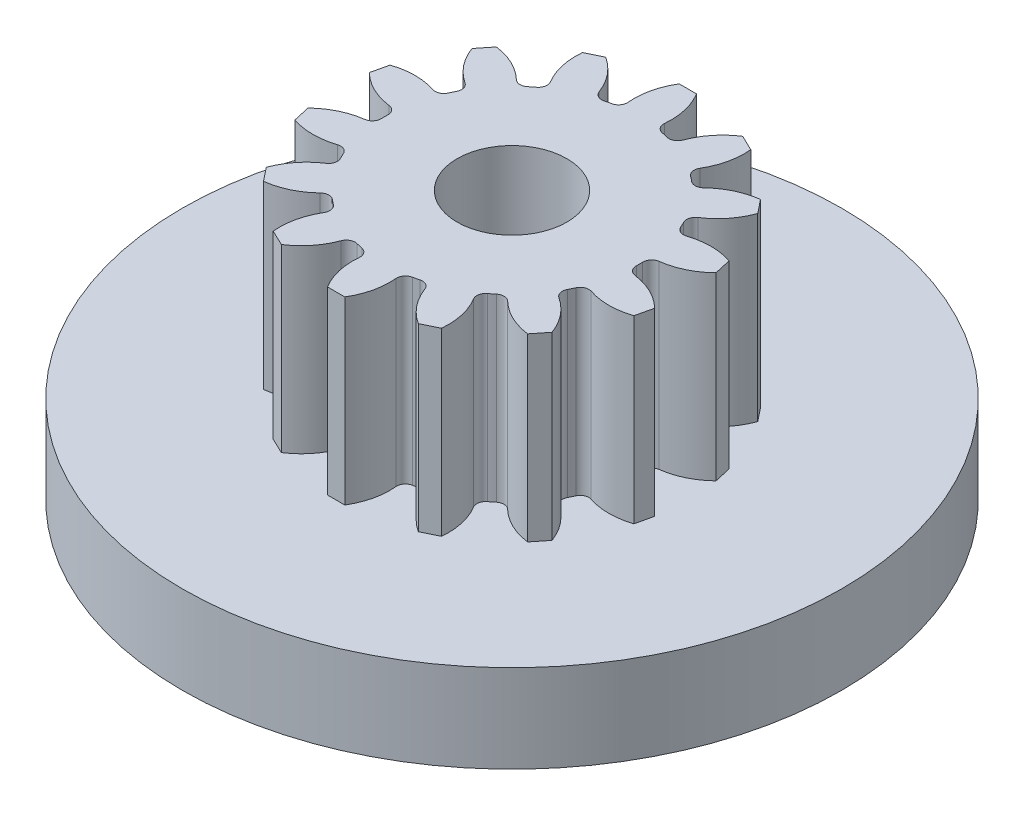
from build123d import *
from build123d.topology import SkipClean

# Parameters (mm, degrees)
SKETCH1_R           = 1.25
BOSS_EXTRUDE1_DEPTH = 4.1
BOSS_EXTRUDE2_START = 2
SKETCH2_R           = 7.5
SKETCH2_R_2         = 1.25
BOSS_EXTRUDE2_DEPTH = 2


with BuildPart() as part:
    # Sketch1 → Boss-Extrude1 (new body)
    with BuildSketch(Plane(origin=(0, 0, 0), x_dir=(1, 0, 0), z_dir=(0, 1, 0))):
        with BuildLine():
            Line((-0.197, 4), (0.197, 4))
            ThreePointArc((0.197, 4), (0.382537799, 3.546229716), (0.415450248, 3.057099349))
            ThreePointArc((0.415450248, 3.057099349), (0.454038062, 2.919195271), (0.574930224, 2.842438256))
            ThreePointArc((0.574930224, 2.842438256), (0.645310708, 2.827290945), (0.715293505, 2.810401253))
            ThreePointArc((0.715293505, 2.810401253), (0.8575172, 2.82710379), (0.952117956, 2.934608447))
            ThreePointArc((0.952117956, 2.934608447), (1.193996761, 3.361019503), (1.558044089, 3.689350568))
            Line((1.558044089, 3.689350568), (1.913025823, 3.518400375))
            ThreePointArc((1.913025823, 3.518400375), (1.883306057, 3.029065642), (1.700733436, 2.574094232))
            ThreePointArc((1.700733436, 2.574094232), (1.675665518, 2.433104326), (1.751281972, 2.311495502))
            ThreePointArc((1.751281972, 2.311495502), (1.808120425, 2.267311299), (1.863844584, 2.221729814))
            ThreePointArc((1.863844584, 2.221729814), (1.999230665, 2.175069732), (2.131107523, 2.230882351))
            ThreePointArc((2.131107523, 2.230882351), (2.534045619, 2.510118158), (3.004498439, 2.647980009))
            Line((3.004498439, 2.647980009), (3.250153421, 2.339938405))
            ThreePointArc((3.250153421, 2.339938405), (3.011062453, 1.911957968), (2.649165509, 1.581258184))
            ThreePointArc((2.649165509, 1.581258184), (2.565406867, 1.46510723), (2.580770847, 1.322732715))
            ThreePointArc((2.580770847, 1.322732715), (2.612809717, 1.258262843), (2.643238384, 1.193017539))
            ThreePointArc((2.643238384, 1.193017539), (2.744971977, 1.092236438), (2.888005108, 1.085302646))
            ThreePointArc((2.888005108, 1.085302646), (3.372195665, 1.162057126), (3.855875025, 1.082144535))
            Line((3.855875025, 1.082144535), (3.943548273, 0.698022937))
            ThreePointArc((3.943548273, 0.698022937), (3.542441002, 0.41616357), (3.072897863, 0.275234559))
            ThreePointArc((3.072897863, 0.275234559), (2.947037924, 0.206927678), (2.899106405, 0.071986492))
            ThreePointArc((2.899106405, 0.071986492), (2.9, 0), (2.899106405, -0.071986492))
            ThreePointArc((2.899106405, -0.071986492), (2.947037924, -0.206927678), (3.072897863, -0.275234559))
            ThreePointArc((3.072897863, -0.275234559), (3.542441002, -0.41616357), (3.943548273, -0.698022937))
            Line((3.943548273, -0.698022937), (3.855875025, -1.082144535))
            ThreePointArc((3.855875025, -1.082144535), (3.372195665, -1.162057126), (2.888005108, -1.085302646))
            ThreePointArc((2.888005108, -1.085302646), (2.744971977, -1.092236438), (2.643238384, -1.193017539))
            ThreePointArc((2.643238384, -1.193017539), (2.612809717, -1.258262843), (2.580770847, -1.322732715))
            ThreePointArc((2.580770847, -1.322732715), (2.565406867, -1.46510723), (2.649165509, -1.581258184))
            ThreePointArc((2.649165509, -1.581258184), (3.011062453, -1.911957968), (3.250153421, -2.339938405))
            Line((3.250153421, -2.339938405), (3.004498439, -2.647980009))
            ThreePointArc((3.004498439, -2.647980009), (2.534045619, -2.510118158), (2.131107523, -2.230882351))
            ThreePointArc((2.131107523, -2.230882351), (1.999230665, -2.175069732), (1.863844584, -2.221729814))
            ThreePointArc((1.863844584, -2.221729814), (1.808120425, -2.267311299), (1.751281972, -2.311495502))
            ThreePointArc((1.751281972, -2.311495502), (1.675665518, -2.433104326), (1.700733436, -2.574094232))
            ThreePointArc((1.700733436, -2.574094232), (1.883306057, -3.029065642), (1.913025823, -3.518400375))
            Line((1.913025823, -3.518400375), (1.558044089, -3.689350568))
            ThreePointArc((1.558044089, -3.689350568), (1.193996761, -3.361019503), (0.952117956, -2.934608447))
            ThreePointArc((0.952117956, -2.934608447), (0.8575172, -2.82710379), (0.715293505, -2.810401253))
            ThreePointArc((0.715293505, -2.810401253), (0.645310708, -2.827290945), (0.574930224, -2.842438256))
            ThreePointArc((0.574930224, -2.842438256), (0.454038062, -2.919195271), (0.415450248, -3.057099349))
            ThreePointArc((0.415450248, -3.057099349), (0.382537799, -3.546229716), (0.197, -4))
            Line((0.197, -4), (-0.197, -4))
            ThreePointArc((-0.197, -4), (-0.382537799, -3.546229716), (-0.415450248, -3.057099349))
            ThreePointArc((-0.415450248, -3.057099349), (-0.454038062, -2.919195271), (-0.574930224, -2.842438256))
            ThreePointArc((-0.574930224, -2.842438256), (-0.645310708, -2.827290945), (-0.715293505, -2.810401253))
            ThreePointArc((-0.715293505, -2.810401253), (-0.8575172, -2.82710379), (-0.952117956, -2.934608447))
            ThreePointArc((-0.952117956, -2.934608447), (-1.193996761, -3.361019503), (-1.558044089, -3.689350568))
            Line((-1.558044089, -3.689350568), (-1.913025823, -3.518400375))
            ThreePointArc((-1.913025823, -3.518400375), (-1.883306057, -3.029065642), (-1.700733436, -2.574094232))
            ThreePointArc((-1.700733436, -2.574094232), (-1.675665518, -2.433104326), (-1.751281972, -2.311495502))
            ThreePointArc((-1.751281972, -2.311495502), (-1.808120425, -2.267311299), (-1.863844584, -2.221729814))
            ThreePointArc((-1.863844584, -2.221729814), (-1.999230665, -2.175069732), (-2.131107523, -2.230882351))
            ThreePointArc((-2.131107523, -2.230882351), (-2.534045619, -2.510118158), (-3.004498439, -2.647980009))
            Line((-3.004498439, -2.647980009), (-3.250153421, -2.339938405))
            ThreePointArc((-3.250153421, -2.339938405), (-3.011062453, -1.911957968), (-2.649165509, -1.581258184))
            ThreePointArc((-2.649165509, -1.581258184), (-2.565406867, -1.46510723), (-2.580770847, -1.322732715))
            ThreePointArc((-2.580770847, -1.322732715), (-2.612809717, -1.258262843), (-2.643238384, -1.193017539))
            ThreePointArc((-2.643238384, -1.193017539), (-2.744971977, -1.092236438), (-2.888005108, -1.085302646))
            ThreePointArc((-2.888005108, -1.085302646), (-3.372195665, -1.162057126), (-3.855875025, -1.082144535))
            Line((-3.855875025, -1.082144535), (-3.943548273, -0.698022937))
            ThreePointArc((-3.943548273, -0.698022937), (-3.542441002, -0.41616357), (-3.072897863, -0.275234559))
            ThreePointArc((-3.072897863, -0.275234559), (-2.947037924, -0.206927678), (-2.899106405, -0.071986492))
            ThreePointArc((-2.899106405, -0.071986492), (-2.9, 0), (-2.899106405, 0.071986492))
            ThreePointArc((-2.899106405, 0.071986492), (-2.947037924, 0.206927678), (-3.072897863, 0.275234559))
            ThreePointArc((-3.072897863, 0.275234559), (-3.542441002, 0.41616357), (-3.943548273, 0.698022937))
            Line((-3.943548273, 0.698022937), (-3.855875025, 1.082144535))
            ThreePointArc((-3.855875025, 1.082144535), (-3.372195665, 1.162057126), (-2.888005108, 1.085302646))
            ThreePointArc((-2.888005108, 1.085302646), (-2.744971977, 1.092236438), (-2.643238384, 1.193017539))
            ThreePointArc((-2.643238384, 1.193017539), (-2.612809717, 1.258262843), (-2.580770847, 1.322732715))
            ThreePointArc((-2.580770847, 1.322732715), (-2.565406867, 1.46510723), (-2.649165509, 1.581258184))
            ThreePointArc((-2.649165509, 1.581258184), (-3.011062453, 1.911957968), (-3.250153421, 2.339938405))
            Line((-3.250153421, 2.339938405), (-3.004498439, 2.647980009))
            ThreePointArc((-3.004498439, 2.647980009), (-2.534045619, 2.510118158), (-2.131107523, 2.230882351))
            ThreePointArc((-2.131107523, 2.230882351), (-1.999230665, 2.175069732), (-1.863844584, 2.221729814))
            ThreePointArc((-1.863844584, 2.221729814), (-1.808120425, 2.267311299), (-1.751281972, 2.311495502))
            ThreePointArc((-1.751281972, 2.311495502), (-1.675665518, 2.433104326), (-1.700733436, 2.574094232))
            ThreePointArc((-1.700733436, 2.574094232), (-1.883306057, 3.029065642), (-1.913025823, 3.518400375))
            Line((-1.913025823, 3.518400375), (-1.558044089, 3.689350568))
            ThreePointArc((-1.558044089, 3.689350568), (-1.193996761, 3.361019503), (-0.952117956, 2.934608447))
            ThreePointArc((-0.952117956, 2.934608447), (-0.8575172, 2.82710379), (-0.715293505, 2.810401253))
            ThreePointArc((-0.715293505, 2.810401253), (-0.645310708, 2.827290945), (-0.574930224, 2.842438256))
            ThreePointArc((-0.574930224, 2.842438256), (-0.454038062, 2.919195271), (-0.415450248, 3.057099349))
            ThreePointArc((-0.415450248, 3.057099349), (-0.382537799, 3.546229716), (-0.197, 4))
        make_face()
        with Locations(Location((0, 0, 0), (0, 0, 270))):
            Circle(SKETCH1_R, mode=Mode.SUBTRACT)
    extrude(amount=BOSS_EXTRUDE1_DEPTH)

    # Sketch2 → Boss-Extrude2 (add)
    with SkipClean():  # the faces are left unmerged after this step: merging them gives an invalid solid
        with BuildSketch(Plane.XZ.offset(BOSS_EXTRUDE2_START)):
            with Locations(Location((0, 0, 0), (0, 0, 270))):
                Circle(SKETCH2_R)
            with Locations(Location((0, 0, 0), (0, 0, 270))):
                Circle(SKETCH2_R_2, mode=Mode.SUBTRACT)
        extrude(amount=-BOSS_EXTRUDE2_DEPTH)


solid = part.part
